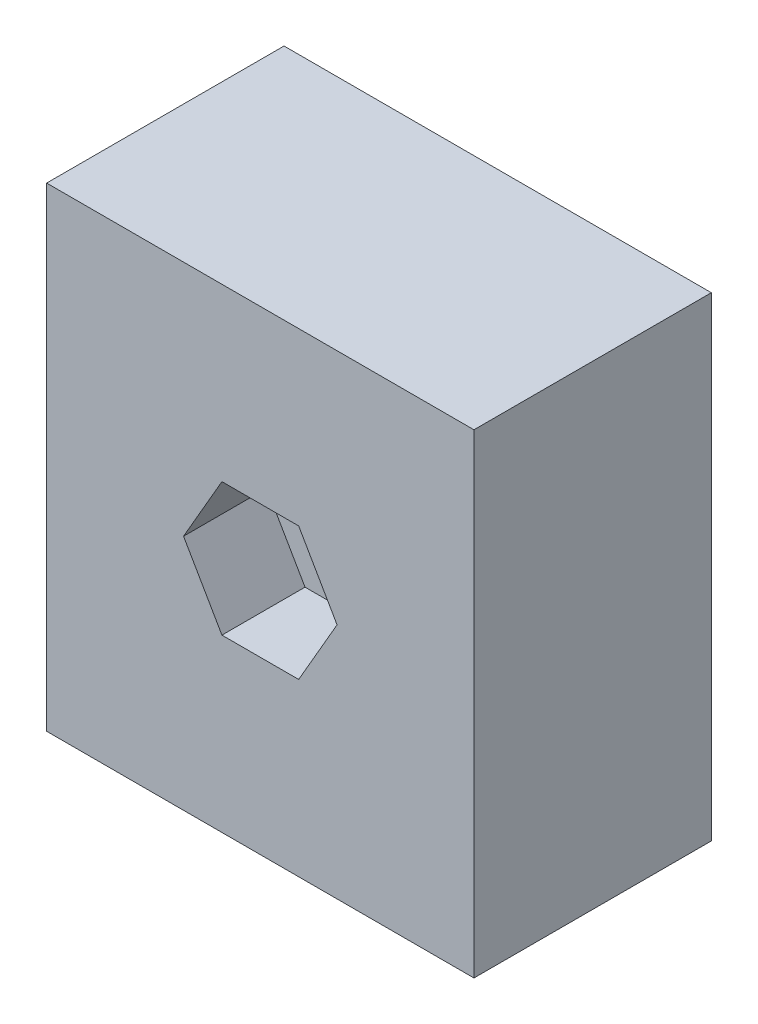
from build123d import *

# Parameters (mm, degrees)
SKETCH1_W           = 18
SKETCH1_H           = 20
BOSS_EXTRUDE1_DEPTH = 10
CUT_EXTRUDE1_DEPTH  = 17.763054614
CUT_EXTRUDE2_DEPTH  = 3.5


with BuildPart() as part:
    # Sketch1 → Boss-Extrude1 (new body)
    with BuildSketch(Plane.XY):
        Rectangle(SKETCH1_W, SKETCH1_H)
    extrude(amount=BOSS_EXTRUDE1_DEPTH)

    # Sketch2 → Cut-Extrude1 (cut, through all)
    with BuildSketch(Plane.XY.offset(10)):
        with BuildLine():
            ThreePointArc((1.8, 0), (1.644300114, 0.732309453), (1.204136517, 1.337929463))
            Line((1.204136517, 1.337929463), (-1.204136517, -1.337929463))
            ThreePointArc((-1.204136517, -1.337929463), (0.732309453, -1.644300114), (1.8, 0))
        make_face()
        with BuildLine():
            Line((-1.204136517, -1.337929463), (1.204136517, 1.337929463))
            ThreePointArc((1.204136517, 1.337929463), (-1.337929463, 1.204136517), (-1.204136517, -1.337929463))
        make_face()
    extrude(amount=-CUT_EXTRUDE1_DEPTH, mode=Mode.SUBTRACT)

    # Sketch3 → Cut-Extrude2 (cut)
    with BuildSketch(Plane.XY.offset(10)):
        Polygon((1.616580754, 2.8), (-1.616580754, 2.8), (-3.233161507, 0), (-1.616580754, -2.8), (1.616580754, -2.8), (3.233161507, 0), align=None)
    extrude(amount=-CUT_EXTRUDE2_DEPTH, mode=Mode.SUBTRACT)


solid = part.part
